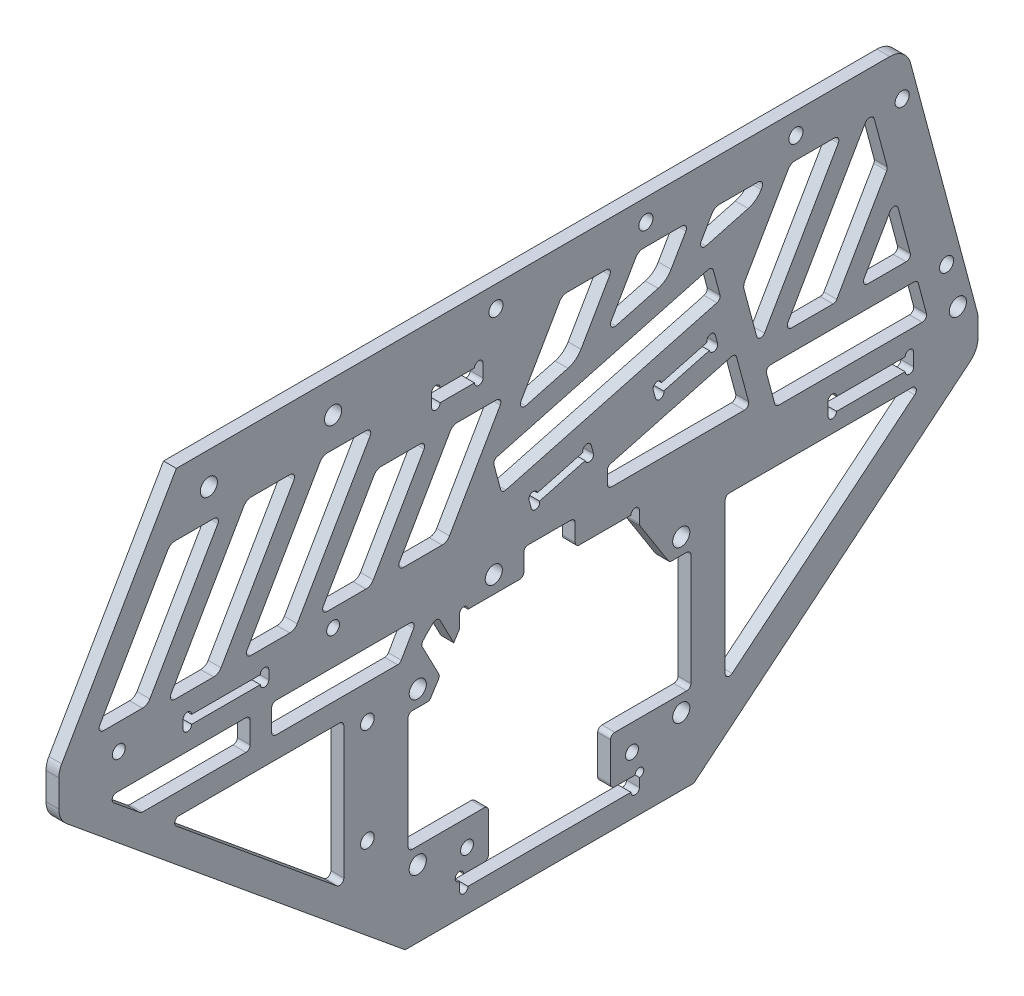
from build123d import *

# Parameters (mm, degrees)
SKETCH_1_R          = 2
SKETCH_1_R_2        = 1.5
SKETCH_1_R_3        = 1.6
SKETCH_1_R_4        = 1.65
SKETCH_1_W          = 20
SKETCH_1_H          = 3
SKETCH_1_H_2        = 2
EXTRUDE_1_DEPTH     = 3
SKETCH_5_R          = 2
SKETCH_5_W          = 12
SKETCH_5_H          = 3
CUT_EXTRUDE_2_DEPTH = 146.977738029
SKETCH_6_R          = 1
CUT_EXTRUDE_3_DEPTH = 146.977738029
CHAMFER_1_SIZE      = 7
CHAMFER_1_SIZE2     = 11
SKETCH_7_W          = 12
SKETCH_7_H          = 6
CUT_EXTRUDE_4_DEPTH = 146.977738029
CHAMFER_2_SIZE      = 11
CHAMFER_2_SIZE2     = 7
FILLET_1_R          = 1
FILLET_2_R          = 5
FILLET_3_R          = 2


with BuildPart() as part:
    # 草图1 → 凸台-拉伸1 (new body)
    with BuildSketch(Plane(origin=(0, 0, 0), x_dir=(0, 0, -1), z_dir=(1, 0, 0))):
        with BuildLine():
            Line((-33.674916481, -33.5), (33.674916481, -33.5))
            Line((33.674916481, -33.5), (100, 21))
            Line((100, 21), (100, 28))
            Line((100, 28), (84.246169665, 86.794095226))
            ThreePointArc((84.246169665, 86.794095226), (82.460347678, 89.466766701), (79.416540533, 90.5))
            Line((79.416540533, 90.5), (-87.075862213, 90.5))
            Line((-87.075862213, 90.5), (-114.5, 43))
            Line((-114.5, 43), (-114.5, 33))
            Line((-114.5, 33), (-33.674916481, -33.5))
        make_face()
        with Locations((-30.743901834, 17.75)):
            Circle(SKETCH_1_R, mode=Mode.SUBTRACT)
        with Locations(Location((-30.743901834, -17.75, 0), (0, 0, 180))):
            Circle(SKETCH_1_R, mode=Mode.SUBTRACT)
        with Locations((30.743901834, -17.75)):
            Circle(SKETCH_1_R, mode=Mode.SUBTRACT)
        with Locations(Location((30.743901834, 17.75, 0), (0, 0, 180))):
            Circle(SKETCH_1_R, mode=Mode.SUBTRACT)
        with Locations((-100.5, 40)):
            Circle(SKETCH_1_R_2, mode=Mode.SUBTRACT)
        with Locations((-42.5, -7)):
            Circle(SKETCH_1_R_3, mode=Mode.SUBTRACT)
        with Locations((-50.5, 40)):
            Circle(SKETCH_1_R_2, mode=Mode.SUBTRACT)
        with Locations((-19.25, -20)):
            Circle(SKETCH_1_R_2, mode=Mode.SUBTRACT)
        with Locations(Location((19.25, -20, 0), (0, 0, 180))):
            Circle(SKETCH_1_R_2, mode=Mode.SUBTRACT)
        with Locations((-13, 32)):
            Circle(SKETCH_1_R, mode=Mode.SUBTRACT)
        with Locations((95.304736599, 32)):
            Circle(SKETCH_1_R, mode=Mode.SUBTRACT)
        with Locations((82.309200766, 80.5)):
            Circle(SKETCH_1_R_4, mode=Mode.SUBTRACT)
        with Locations((92.66196257, 41.862966948)):
            Circle(SKETCH_1_R_4, mode=Mode.SUBTRACT)
        with Locations((-12.5, 85.5)):
            Circle(SKETCH_1_R_4, mode=Mode.SUBTRACT)
        with Locations((22.5, 85.5)):
            Circle(SKETCH_1_R_4, mode=Mode.SUBTRACT)
        with Locations((57.5, 85.5)):
            Circle(SKETCH_1_R_4, mode=Mode.SUBTRACT)
        with Locations((-42.5, 17)):
            Circle(SKETCH_1_R_3, mode=Mode.SUBTRACT)
        Polygon((-21, 28), (21, 28), (21, 14), (33, 14), (33, -14), (14.25, -14), (14.25, -25), (21, -25), (21, -28), (-21, -28), (-21, -25), (-14.25, -25), (-14.25, -14), (-33, -14), (-33, 14), (-21, 14), align=None, mode=Mode.SUBTRACT)
        Polygon((41, 21), (41, -17.126518665), (87.398982289, 21), align=None, mode=Mode.SUBTRACT)
        with Locations((75, 26.5)):
            Rectangle(SKETCH_1_W, SKETCH_1_H, mode=Mode.SUBTRACT)
        with Locations((-75.5, 38)):
            Rectangle(SKETCH_1_W, SKETCH_1_H_2, mode=Mode.SUBTRACT)
    extrude(amount=EXTRUDE_1_DEPTH)

    # 草图5 → 切除-拉伸2 (cut, through all)
    with BuildSketch(Plane(origin=(3, 0, 0), x_dir=(0, 0, -1), z_dir=(1, 0, 0))):
        with Locations((23.570015069, -299.362630979)):
            Circle(SKETCH_5_R)
        with Locations((-5.429984931, -299.362630979)):
            Circle(SKETCH_5_R)
        with Locations((-50.5, 83)):
            Circle(SKETCH_5_R)
        with Locations((-79.5, 83)):
            Circle(SKETCH_5_R)
        Polygon((40.043887301, 61.150720775), (-11.150181492, 47.433311385), (-13.220733853, 55.160717995), (37.97333494, 68.878127386), align=None)
        Polygon((9.721249304, 46.814137329), (10.238887394, 44.882285677), (-4.25, 41), (-4.76763809, 42.931851653), align=None)
        Polygon((38.699024093, 54.578708682), (39.216662183, 52.64685703), (24.727774789, 48.764571353), (24.210136698, 50.696423006), align=None)
        with Locations((-21.5, 74.5)):
            Rectangle(SKETCH_5_W, SKETCH_5_H)
    extrude(amount=-CUT_EXTRUDE_2_DEPTH, mode=Mode.SUBTRACT)

    # 草图6 → 切除-拉伸3 (cut, through all)
    with BuildSketch(Plane(origin=(3, 0, 0), x_dir=(0, 0, -1), z_dir=(1, 0, 0))):
        with Locations((-20, 28)):
            Circle(SKETCH_6_R)
        with Locations((20, 28)):
            Circle(SKETCH_6_R)
        with Locations((20, -28)):
            Circle(SKETCH_6_R)
        with Locations((-20, -28)):
            Circle(SKETCH_6_R)
        with Locations((66, 28)):
            Circle(SKETCH_6_R)
        with Locations((66, 25)):
            Circle(SKETCH_6_R)
        with Locations((84, 28)):
            Circle(SKETCH_6_R)
        with Locations((84, 25)):
            Circle(SKETCH_6_R)
        with Locations((-26.5, 76)):
            Circle(SKETCH_6_R)
        with Locations((-26.5, 73)):
            Circle(SKETCH_6_R)
        with Locations((-16.5, 76)):
            Circle(SKETCH_6_R)
        with Locations((-16.5, 73)):
            Circle(SKETCH_6_R)
        with Locations((-21, -25)):
            Circle(SKETCH_6_R)
        with Locations((21, -25)):
            Circle(SKETCH_6_R)
        with BuildLine():
            Line((24.727774789, 48.764571353), (26.659626441, 49.282209443))
            ThreePointArc((26.659626441, 49.282209443), (25.95251966, 48.057464572), (24.727774789, 48.764571353))
        make_face()
        with BuildLine():
            Line((38.699024093, 54.578708682), (36.76717244, 54.061070592))
            ThreePointArc((36.76717244, 54.061070592), (37.474279221, 55.285815463), (38.699024093, 54.578708682))
        make_face()
        with BuildLine():
            Line((9.721249304, 46.814137329), (7.789397652, 46.296499239))
            ThreePointArc((7.789397652, 46.296499239), (8.496504433, 47.52124411), (9.721249304, 46.814137329))
        make_face()
        with BuildLine():
            Line((-4.25, 41), (-2.318148347, 41.51763809))
            ThreePointArc((-2.318148347, 41.51763809), (-3.025255129, 40.292893219), (-4.25, 41))
        make_face()
        with BuildLine():
            Line((-2.835786438, 43.449489743), (-4.76763809, 42.931851653))
            ThreePointArc((-4.76763809, 42.931851653), (-4.060531309, 44.156596524), (-2.835786438, 43.449489743))
        make_face()
        with BuildLine():
            Line((8.307035742, 44.364647586), (10.238887394, 44.882285677))
            ThreePointArc((10.238887394, 44.882285677), (9.531780613, 43.657540805), (8.307035742, 44.364647586))
        make_face()
        with BuildLine():
            Line((26.141988351, 51.214061096), (24.210136698, 50.696423006))
            ThreePointArc((24.210136698, 50.696423006), (24.91724348, 51.921167877), (26.141988351, 51.214061096))
        make_face()
        with BuildLine():
            Line((37.28481053, 52.129218939), (39.216662183, 52.64685703))
            ThreePointArc((39.216662183, 52.64685703), (38.509555402, 51.422112158), (37.28481053, 52.129218939))
        make_face()
        with BuildLine():
            Line((-85.5, 37), (-83.5, 37))
            ThreePointArc((-83.5, 37), (-84.5, 36), (-85.5, 37))
        make_face()
        with BuildLine():
            Line((-65.5, 39), (-67.5, 39))
            ThreePointArc((-67.5, 39), (-66.5, 40), (-65.5, 39))
        make_face()
        with BuildLine():
            Line((-83.5, 39), (-85.5, 39))
            ThreePointArc((-85.5, 39), (-84.5, 40), (-83.5, 39))
        make_face()
        with BuildLine():
            Line((-67.5, 37), (-65.5, 37))
            ThreePointArc((-65.5, 37), (-66.5, 36), (-67.5, 37))
        make_face()
    extrude(amount=-CUT_EXTRUDE_3_DEPTH, mode=Mode.SUBTRACT)

    # 倒角1
    chamfer_1_edges = [part.edges().sort_by_distance(p)[0] for p in [
        (1.5, 14, 21),
    ]]
    chamfer_1_side = [part.faces().sort_by_distance(p)[0] for p in [
        (1.5, 14, 27),
    ]]
    chamfer(chamfer_1_edges, length=CHAMFER_1_SIZE, length2=CHAMFER_1_SIZE2, reference=chamfer_1_side[0])

    # 草图7 → 切除-拉伸4 (cut, through all)
    with BuildSketch(Plane(origin=(3, 0, 0), x_dir=(0, 0, -1), z_dir=(1, 0, 0))):
        Polygon((-53.678054802, 44), (-41.679426927, 44), (-28.400370736, 67), (-40.39899861, 67), align=None)
        Polygon((-105.839745962, 46), (-93.841118088, 46), (-76.520610012, 76), (-88.519237886, 76), align=None)
        Polygon((-59.451557494, 44), (-40.97634888, 76), (-52.974976754, 76), (-71.450185368, 44), align=None)
        Polygon((-23.907296361, 44), (-35.905924235, 44), (-22.626868044, 67), (-10.62824017, 67), align=None)
        Polygon((-7.874499962, 61.769617951), (2.939491156, 80.5), (14.938119031, 80.5), (6.320029219, 65.573030582), align=None)
        Polygon((13.150156238, 67.403157601), (20.711621723, 80.5), (32.710249597, 80.5), (27.344685418, 71.206570232), align=None)
        Polygon((34.174812437, 73.036697251), (38.483752289, 80.5), (50.482380163, 80.5), (48.369341618, 76.840109881), align=None)
        Polygon((45.177254004, 61.311251952), (56.255882855, 80.5), (68.25451073, 80.5), (48.980666635, 47.116722771), align=None)
        Polygon((54.754169327, 47.116722771), (66.752797201, 47.116722771), (78.891388118, 68.141378971), (75.579905593, 80.5), (74.028013421, 80.5), align=None)
        Polygon((72.526299893, 47.116722771), (84.524927767, 47.116722771), (80.721515137, 61.311251952), align=None)
        Polygon((-103.841048161, 32), (-95.333144633, 25), (-69.838273876, 25), (-69.838273876, 32), align=None)
        Polygon((-89.222315934, 44), (-77.22368806, 44), (-58.748479446, 76), (-70.74710732, 76), align=None)
        Polygon((-64.838273876, 32), (-64.838273876, 25), (-34.876951476, 25), (-30.835499591, 32), align=None)
        Polygon((13.5, 40.579717264), (43.408534887, 48.593685033), (46.783002622, 36), (13.5, 36), align=None)
        Polygon((52.763231101, 33), (88.307492234, 33), (85.86467373, 42.116722771), (50.320412597, 42.116722771), align=None)
        Polygon((-89.256070684, 20), (-48, 20), (-48, -13.944025555), align=None)
        with Locations((0, 31)):
            Rectangle(SKETCH_7_W, SKETCH_7_H)
        with BuildLine():
            Line((-22.34218873, 22.890846281), (-25.557365079, 29.059567968))
            ThreePointArc((-25.557365079, 29.059567968), (-26.272975683, 29.582615297), (-27.12306902, 29.33158071))
            ThreePointArc((-27.12306902, 29.33158071), (-28.361141088, 28.136243107), (-29.54658423, 26.888693913))
            ThreePointArc((-29.54658423, 26.888693913), (-29.798694636, 26.344212478), (-29.693773697, 25.753440707))
            Line((-29.693773697, 25.753440707), (-25.563441684, 17.828877354))
            Line((-25.563441684, 17.828877354), (-22.34218873, 22.890846281))
        make_face()
    extrude(amount=-CUT_EXTRUDE_4_DEPTH, mode=Mode.SUBTRACT)

    # 倒角2
    chamfer_2_edges = [part.edges().sort_by_distance(p)[0] for p in [
        (1.5, 14, -21),
    ]]
    chamfer_2_side = [part.faces().sort_by_distance(p)[0] for p in [
        (1.5, 21, -21),
    ]]
    chamfer(chamfer_2_edges, length=CHAMFER_2_SIZE, length2=CHAMFER_2_SIZE2, reference=chamfer_2_side[0])

    # 圆角1
    fillet_1_edges = [part.edges().sort_by_distance(p)[0] for p in [
        (1.5, 68.878127386, -37.97333494),
        (1.5, 61.150720775, -40.043887301),
        (1.5, 47.433311385, 11.150181492),
        (1.5, 55.160717995, 13.220733853),
        (1.5, -14, 33),
        (1.5, -14, 14.25),
        (1.5, -25, 14.25),
        (1.5, -25, -14.25),
        (1.5, -14, -14.25),
        (1.5, -14, -33),
        (1.5, 14, -33),
        (1.5, 14, 33),
        (1.5, 14, 28),
        (1.5, 17.828877354, 25.563441684),
        (1.5, 48.593685033, -43.408534887),
        (1.5, 36, -46.783002622),
        (1.5, 36, -13.5),
        (1.5, 40.579717264, -13.5),
        (1.5, 44, 71.450185368),
        (1.5, 76, 40.97634888),
        (1.5, 76, 58.748479446),
        (1.5, 44, 89.222315934),
        (1.5, 32, 64.838273876),
        (1.5, 32, 30.835499591),
        (1.5, 25, 34.876951476),
        (1.5, 25, 64.838273876),
        (1.5, 32, 69.838273876),
        (1.5, 25, 69.838273876),
        (1.5, 25, 95.333144633),
        (1.5, 32, 103.841048161),
        (1.5, -13.944025555, 48),
        (1.5, 20, 89.256070684),
        (1.5, 20, 48),
        (1.5, 33, -52.763231101),
        (1.5, 42.116722771, -50.320412597),
        (1.5, 42.116722771, -85.86467373),
        (1.5, 33, -88.307492234),
        (1.5, 80.5, -75.579905593),
        (1.5, 68.141378971, -78.891388118),
        (1.5, 47.116722771, -66.752797201),
        (1.5, 47.116722771, -54.754169327),
        (1.5, 80.5, -74.028013421),
        (1.5, 73.036697251, -34.174812437),
        (1.5, 80.5, -50.482380163),
        (1.5, 61.311251952, -80.721515137),
        (1.5, 47.116722771, -84.524927767),
        (1.5, 47.116722771, -72.526299893),
        (1.5, 47.116722771, -48.980666635),
        (1.5, 80.5, -68.25451073),
        (1.5, 76, 76.520610012),
        (1.5, 46, 105.839745962),
        (1.5, 44, 53.678054802),
        (1.5, 67, 28.400370736),
        (1.5, 67, 10.62824017),
        (1.5, 44, 35.905924235),
        (1.5, 80.5, -32.710249597),
        (1.5, 67.403157601, -13.150156238),
        (1.5, 28, 6),
        (1.5, 34, 6),
        (1.5, 34, -6),
        (1.5, 28, -6),
        (1.5, 80.5, -14.938119031),
        (1.5, 61.769617951, 7.874499962),
        (1.5, 14, -28),
        (1.5, 25, -21),
        (1.5, 21, -87.398982289),
        (1.5, 21, -41),
        (1.5, -17.126518665, -41),
    ]]
    fillet(fillet_1_edges, radius=FILLET_1_R)

    # 圆角2
    fillet_2_edges = [part.edges().sort_by_distance(p)[0] for p in [
        (1.5, 33, 114.5),
        (1.5, 43, 114.5),
        (1.5, 28, -100),
        (1.5, 21, -100),
        (1.5, 76.840109881, -48.369341618),
        (1.5, 71.206570232, -27.344685418),
        (1.5, 65.573030582, -6.320029219),
    ]]
    fillet(fillet_2_edges, radius=FILLET_2_R)

    # 圆角3
    fillet_3_edges = [part.edges().sort_by_distance(p)[0] for p in [
        (1.5, 44, 59.451557494),
        (1.5, 76, 52.974976754),
        (1.5, 76, 70.74710732),
        (1.5, 44, 77.22368806),
        (1.5, 80.5, -38.483752289),
        (1.5, 61.311251952, -45.177254004),
        (1.5, 80.5, -56.255882855),
        (1.5, 76, 88.519237886),
        (1.5, 46, 93.841118088),
        (1.5, 67, 40.39899861),
        (1.5, 44, 41.679426927),
        (1.5, 44, 23.907296361),
        (1.5, 67, 22.626868044),
        (1.5, 80.5, -20.711621723),
        (1.5, 80.5, -2.939491156),
    ]]
    fillet(fillet_3_edges, radius=FILLET_3_R)


solid = part.part
